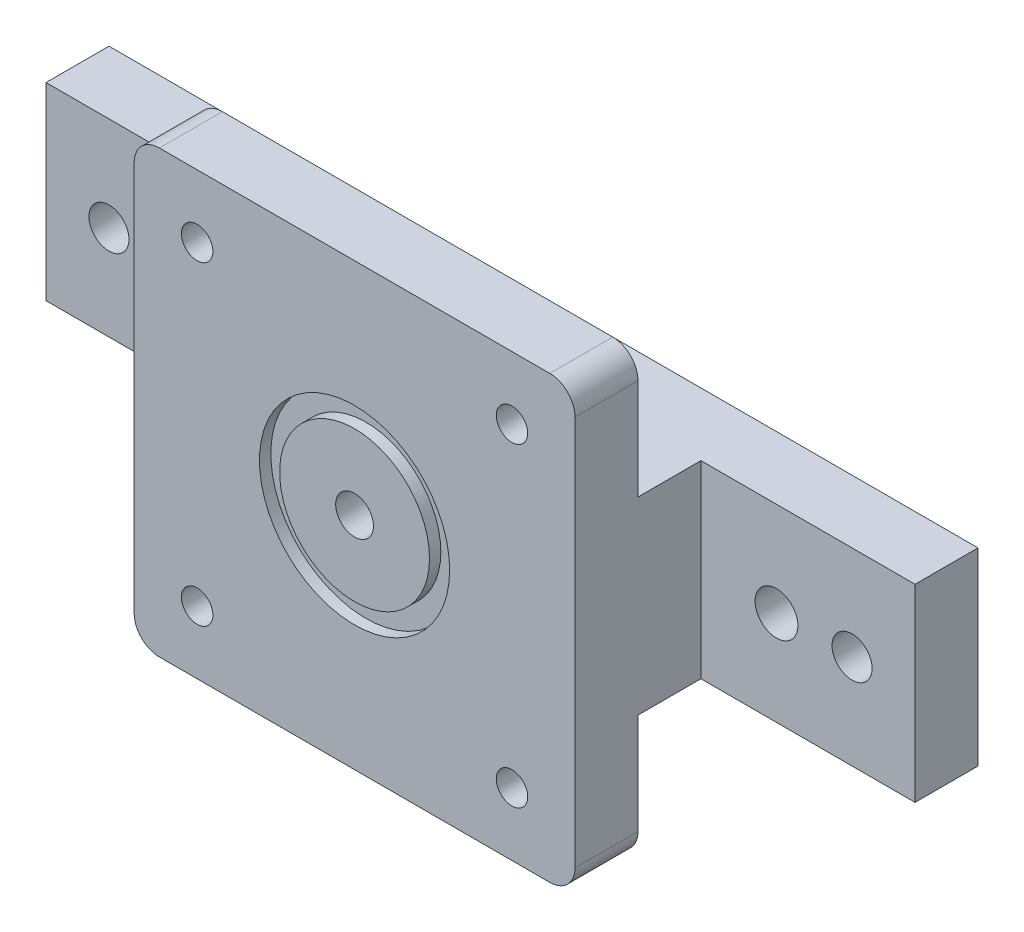
from build123d import *

# Parameters (mm, degrees)
SKETCH1_W                                = 60
SKETCH1_H                                = 20
BOSS_EXTRUDE1_DEPTH                      = 37
CUT_EXTRUDE2_DEPTH                       = 74.273460407
CUT_EXTRUDE2_DEPTH_BACK                  = 74.273460407
SKETCH7_W                                = 60
SKETCH7_H                                = 5
SKETCH16_R                               = 1.75
BOSS_EXTRUDE3_DEPTH                      = 1.85
SKETCH27_W                               = 0.34
SKETCH27_H                               = 37
SKETCH27_W_2                             = 4.66
CUT_EXTRUDE9_DEPTH                       = 73.069410987
SKETCH28_W                               = 8.45
SKETCH28_H                               = 32
CUT_EXTRUDE10_DEPTH                      = 72.786597635
CUT_EXTRUDE13_DEPTH                      = 72.786597635
CUT_EXTRUDE13_DEPTH_BACK                 = 72.786597635
SKETCH35_OUTSIDE_W                       = 70.68
SKETCH35_OUTSIDE_H                       = 52.68
SKETCH35_OUTSIDE_W_2                     = 38.1
SKETCH35_OUTSIDE_H_2                     = 20
CUT_EXTRUDE14_DEPTH                      = 65.934306033
CUT_EXTRUDE14_DEPTH_BACK                 = 65.934306033
SKETCH39_W                               = 7
SKETCH39_H                               = 10
M3_CLEARANCE_HOLE2_D                     = 3.4
TAP_DRILL_FOR_10_32_TAP1_D               = 4.0386
TAP_DRILL_FOR_10_32_TAP1_DEPTH           = 5
TAP_DRILL_FOR_10_32_TAP1_TIP             = 1.213317848
SKETCH6_R                                = 0.625
CUT_EXTRUDE1_DEPTH                       = 27
SKETCH44_W                               = 0.62
SKETCH44_H                               = 12.45
SKETCH48_R                               = 1.58
CUT_EXTRUDE17_DEPTH                      = 8
SKETCH49_R                               = 1.709194905
SKETCH49_R_2                             = 1.7
SKETCH49_R_3                             = 1.58
BOSS_EXTRUDE4_DEPTH                      = 10
BOSS_EXTRUDE5_START                      = 17
SKETCH50_W                               = 38.1
SKETCH50_H                               = 15
SKETCH50_R                               = 0.625
BOSS_EXTRUDE5_DEPTH                      = 17
SKETCH53_W                               = 15.45
SKETCH53_H                               = 15
BOSS_EXTRUDE6_DEPTH                      = 5
SKETCH54_R                               = 1.75
BOSS_EXTRUDE7_DEPTH                      = 1.85
TAP_DRILL_FOR_M2_5X0_45_TAP2_D           = 2.05
TAP_DRILL_FOR_M2_5X0_45_TAP2_DEPTH       = 4
TAP_DRILL_FOR_M2_5X0_45_TAP2_CSINK_D     = 2.1
TAP_DRILL_FOR_M2_5X0_45_TAP2_CSINK_ANGLE = 90
TAP_DRILL_FOR_M2_5X0_45_TAP2_TIP         = 0.615882135
M3_CLEARANCE_HOLE1_D                     = 3.4
SKETCH56_R                               = 1.59
CUT_EXTRUDE21_DEPTH                      = 5
SKETCH57_W                               = 13
SKETCH57_H                               = 5
CUT_EXTRUDE22_DEPTH                      = 0.8
FILLET1_R                                = 0.79
SKETCH58_W                               = 7
SKETCH58_H                               = 10
BOSS_EXTRUDE8_DEPTH                      = 15
TAP_DRILL_FOR_M3X0_5_TAP1_D              = 2.5
SKETCH59_W                               = 38.1
SKETCH59_H                               = 22
CUT_EXTRUDE23_DEPTH                      = 78.701709119
F_3_0MM_DOWEL_HOLE1_D                    = 3
F_3_0MM_DOWEL_HOLE1_DEPTH                = 5
F_3_0MM_DOWEL_HOLE1_TIP                  = 0.901290929
SKETCH65_W                               = 35
SKETCH65_H                               = 35
SKETCH65_R                               = 1
SKETCH65_R_2                             = 4
BOSS_EXTRUDE9_DEPTH                      = 5
SKETCH64_R                               = 7.55
SKETCH64_R_2                             = 5.95
CUT_EXTRUDE24_DEPTH                      = 0.9
TAP_DRILL_FOR_M3X0_5_TAP2_D              = 2.5
SKETCH68_W                               = 1.55
SKETCH68_H                               = 10
CUT_EXTRUDE25_DEPTH                      = 73.756825109
FILLET2_R                                = 2


with BuildPart() as part:
    # Sketch1 → Boss-Extrude1 (new body)
    with BuildSketch(Plane.XY):
        with Locations((30, 10)):
            Rectangle(SKETCH1_W, SKETCH1_H)
    extrude(amount=BOSS_EXTRUDE1_DEPTH)

    # Sketch7 → Cut-Extrude2 (cut, two sides: drawn at the far end of the back side and taken through both)
    with BuildSketch(Plane(origin=(0, 0, 0), x_dir=(-1, 0, 0), z_dir=(0, 0, -1)).offset(-CUT_EXTRUDE2_DEPTH_BACK)):
        with Locations((-30, 2.5)):
            Rectangle(SKETCH7_W, SKETCH7_H)
    extrude(amount=CUT_EXTRUDE2_DEPTH + CUT_EXTRUDE2_DEPTH_BACK, mode=Mode.SUBTRACT)

    # Sketch16 → Boss-Extrude3 (add)
    with BuildSketch(Plane(origin=(0, 20, 0), x_dir=(1, 0, 0), z_dir=(0, 1, 0))):
        with Locations(Location((34.7475, -4.83, 0), (0, 0, 90))):
            Circle(SKETCH16_R)
    extrude(amount=BOSS_EXTRUDE3_DEPTH)

    # Sketch27 → Cut-Extrude9 (cut, through all)
    with BuildSketch(Plane(origin=(0, 20, 0), x_dir=(1, 0, 0), z_dir=(0, 1, 0))):
        with Locations((59.83, -18.5)):
            Rectangle(SKETCH27_W, SKETCH27_H)
        with Locations((2.33, -18.5)):
            Rectangle(SKETCH27_W_2, SKETCH27_H)
    extrude(amount=-CUT_EXTRUDE9_DEPTH, mode=Mode.SUBTRACT)

    # Sketch28 → Cut-Extrude10 (cut, through all)
    with BuildSketch(Plane(origin=(0, 20, 0), x_dir=(1, 0, 0), z_dir=(0, 1, 0))):
        with Locations((55.435, -21)):
            Rectangle(SKETCH28_W, SKETCH28_H)
        with Locations((8.885, -21)):
            Rectangle(SKETCH28_W, SKETCH28_H)
    extrude(amount=-CUT_EXTRUDE10_DEPTH, mode=Mode.SUBTRACT)

    # Sketch35 outside → Cut-Extrude13 (cut, two sides: drawn at the far end of the back side and taken through both)
    with BuildSketch(Plane(origin=(0, 20, 0), x_dir=(1, 0, 0), z_dir=(0, 1, 0)).offset(-CUT_EXTRUDE13_DEPTH_BACK)):
        with Locations((32.16, -18.5)):
            Rectangle(SKETCH35_OUTSIDE_W, SKETCH35_OUTSIDE_H)
        with Locations((32.16, -27)):
            Rectangle(SKETCH35_OUTSIDE_W_2, SKETCH35_OUTSIDE_H_2, mode=Mode.SUBTRACT)
    extrude(amount=CUT_EXTRUDE13_DEPTH + CUT_EXTRUDE13_DEPTH_BACK, mode=Mode.SUBTRACT)

    # Sketch39 → Cut-Extrude14 (cut, two sides: drawn at the far end of the back side and taken through both)
    with BuildSketch(Plane(origin=(0, 20, 0), x_dir=(1, 0, 0), z_dir=(0, 1, 0)).offset(-CUT_EXTRUDE14_DEPTH_BACK)):
        with Locations((16.61, -32)):
            Rectangle(SKETCH39_W, SKETCH39_H)
        with Locations((47.71, -32)):
            Rectangle(SKETCH39_W, SKETCH39_H)
    extrude(amount=CUT_EXTRUDE14_DEPTH + CUT_EXTRUDE14_DEPTH_BACK, mode=Mode.SUBTRACT)

    # M3 Clearance Hole2 (through all)
    with Locations(Plane.XY.offset(27)):
        with Locations((17.11, 12.5), (47.21, 12.5)):
            Hole(M3_CLEARANCE_HOLE2_D / 2)

    # Tap Drill for #10-32 Tap1
    with Locations(Plane.XY.offset(37)):
        with Locations((32.16, 12.5)):
            Hole(TAP_DRILL_FOR_10_32_TAP1_D / 2, depth=TAP_DRILL_FOR_10_32_TAP1_DEPTH)
            with Locations((0, 0, -(TAP_DRILL_FOR_10_32_TAP1_DEPTH + TAP_DRILL_FOR_10_32_TAP1_TIP / 2))):  # 118° drill point
                Cone(0, TAP_DRILL_FOR_10_32_TAP1_D / 2, TAP_DRILL_FOR_10_32_TAP1_TIP, mode=Mode.SUBTRACT)

    # Sketch6 → Cut-Extrude1 (cut)
    with BuildSketch(Plane(origin=(0, 0, 17), x_dir=(-1, 0, 0), z_dir=(0, 0, -1))):
        with Locations((-32.16, 12.5)):
            Circle(SKETCH6_R)
    extrude(amount=-CUT_EXTRUDE1_DEPTH, mode=Mode.SUBTRACT)

    # Sketch44 → Cut-Revolve1 (revolve, cut)
    with BuildSketch(Plane(origin=(0, 12.5, 0), x_dir=(1, 0, 0), z_dir=(0, 1, 0))):
        Polygon((34.18, -37), (32.16, -37), (32.16, -29.45), (32.78, -29.45), (34.18, -30.29), align=None)
        with Locations((32.47, -23.225)):
            Rectangle(SKETCH44_W, SKETCH44_H)
    revolve(axis=Axis((32.16, 12.5, 37), (0, 0, -1)), mode=Mode.SUBTRACT)

    # Sketch48 → Cut-Extrude17 (cut)
    with BuildSketch(Plane(origin=(0, 0, 17), x_dir=(-1, 0, 0), z_dir=(0, 0, -1))):
        with Locations((-37.21, 15)):
            Circle(SKETCH48_R)
        with Locations((-27.11, 15)):
            Circle(SKETCH48_R)
    extrude(amount=-CUT_EXTRUDE17_DEPTH, mode=Mode.SUBTRACT)

    # Sketch49 → Boss-Extrude4 (add)
    with BuildSketch(Plane(origin=(0, 0, 17), x_dir=(-1, 0, 0), z_dir=(0, 0, -1))):
        with Locations((-47.21, 12.5)):
            Circle(SKETCH49_R)
        with Locations((-17.11, 12.5)):
            Circle(SKETCH49_R_2)
        with Locations((-27.11, 15)):
            Circle(SKETCH49_R_3)
        with Locations((-37.21, 15)):
            Circle(SKETCH49_R_3)
    extrude(amount=-BOSS_EXTRUDE4_DEPTH)

    # Sketch50 → Boss-Extrude5 (add)
    with BuildSketch(Plane(origin=(0, 0, 17), x_dir=(-1, 0, 0), z_dir=(0, 0, -1)).offset(BOSS_EXTRUDE5_START)):
        with Locations((-32.16, 12.5)):
            Rectangle(SKETCH50_W, SKETCH50_H)
        with Locations((-32.16, 12.5)):
            Circle(SKETCH50_R, mode=Mode.SUBTRACT)
    extrude(amount=-BOSS_EXTRUDE5_DEPTH)

    # Sketch53 → Boss-Extrude6 (add)
    with BuildSketch(Plane(origin=(0, 0, 0), x_dir=(-1, 0, 0), z_dir=(0, 0, -1))):
        with Locations((-5.385, 12.5)):
            Rectangle(SKETCH53_W, SKETCH53_H)
        with Locations((-58.935, 12.5)):
            Rectangle(SKETCH53_W, SKETCH53_H)
    extrude(amount=-BOSS_EXTRUDE6_DEPTH)

    # Sketch54 → Boss-Extrude7 (add)
    with BuildSketch(Plane(origin=(0, 20, 0), x_dir=(1, 0, 0), z_dir=(0, 1, 0))):
        with Locations(Location((34.7475, -4.83, 0), (0, 0, 90))):
            Circle(SKETCH54_R)
    extrude(amount=BOSS_EXTRUDE7_DEPTH)

    # Tap Drill for M2.5x0.45 Tap2
    with Locations(Plane(origin=(0, 21.85, 0), x_dir=(1, 0, 0), z_dir=(0, 1, 0))):
        with Locations((34.7475, -4.83)):
            CounterSinkHole(TAP_DRILL_FOR_M2_5X0_45_TAP2_D / 2, TAP_DRILL_FOR_M2_5X0_45_TAP2_CSINK_D / 2, depth=TAP_DRILL_FOR_M2_5X0_45_TAP2_DEPTH, counter_sink_angle=TAP_DRILL_FOR_M2_5X0_45_TAP2_CSINK_ANGLE)
            with Locations((0, 0, -(TAP_DRILL_FOR_M2_5X0_45_TAP2_DEPTH + TAP_DRILL_FOR_M2_5X0_45_TAP2_TIP / 2))):  # 118° drill point
                Cone(0, TAP_DRILL_FOR_M2_5X0_45_TAP2_D / 2, TAP_DRILL_FOR_M2_5X0_45_TAP2_TIP, mode=Mode.SUBTRACT)

    # M3 Clearance Hole1 (through all)
    with Locations(Plane(origin=(0, 0, 0), x_dir=(1, 0, 0), z_dir=(0, 0, -1))):
        with Locations((8.66, -12.5), (55.66, -12.5)):
            Hole(M3_CLEARANCE_HOLE1_D / 2)

    # Sketch56 → Cut-Extrude21 (cut)
    with BuildSketch(Plane(origin=(0, 0, 0), x_dir=(-1, 0, 0), z_dir=(0, 0, -1))):
        with Locations((-61.66, 12.5)):
            Circle(SKETCH56_R)
        with Locations((-2.66, 12.5)):
            Circle(SKETCH56_R)
    extrude(amount=-CUT_EXTRUDE21_DEPTH, mode=Mode.SUBTRACT)

    # Sketch57 → Cut-Extrude22 (cut)
    with BuildSketch(Plane(origin=(0, 0, 0), x_dir=(-1, 0, 0), z_dir=(0, 0, -1))):
        with Locations((-32.16, 12.5)):
            Rectangle(SKETCH57_W, SKETCH57_H)
    extrude(amount=-CUT_EXTRUDE22_DEPTH, mode=Mode.SUBTRACT)

    # Fillet1
    fillet1_edges = [part.edges().sort_by_distance(p)[0] for p in [
        (38.66, 10, 0.4),
        (38.66, 15, 0.4),
        (25.66, 15, 0.4),
        (25.66, 10, 0.4),
    ]]
    fillet(fillet1_edges, radius=FILLET1_R)

    # Sketch58 → Boss-Extrude8 (add)
    with BuildSketch(Plane(origin=(0, 20, 0), x_dir=(1, 0, 0), z_dir=(0, 1, 0))):
        with Locations((16.61, -32)):
            Rectangle(SKETCH58_W, SKETCH58_H)
        with Locations((47.71, -32)):
            Rectangle(SKETCH58_W, SKETCH58_H)
    extrude(amount=-BOSS_EXTRUDE8_DEPTH)

    # Tap Drill for M3x0.5 Tap1 (through all)
    with Locations(Plane(origin=(0, 5, 0), x_dir=(-1, 0, 0), z_dir=(0, -1, 0))):
        with Locations((-16.61, -33.5), (-47.71, -33.5)):
            Hole(TAP_DRILL_FOR_M3X0_5_TAP1_D / 2)

    # Sketch59 → Cut-Extrude23 (cut, through all)
    with BuildSketch(Plane(origin=(0, 20, 0), x_dir=(1, 0, 0), z_dir=(0, 1, 0))):
        with Locations((32.16, -26)):
            Rectangle(SKETCH59_W, SKETCH59_H)
    extrude(amount=-CUT_EXTRUDE23_DEPTH, mode=Mode.SUBTRACT)

    # Ø3.0mm Dowel Hole1
    with Locations(Plane.XY.offset(15)):
        with Locations((32.16, 12.5)):
            Hole(F_3_0MM_DOWEL_HOLE1_D / 2, depth=F_3_0MM_DOWEL_HOLE1_DEPTH)
            with Locations((0, 0, -(F_3_0MM_DOWEL_HOLE1_DEPTH + F_3_0MM_DOWEL_HOLE1_TIP / 2))):  # 118° drill point
                Cone(0, F_3_0MM_DOWEL_HOLE1_D / 2, F_3_0MM_DOWEL_HOLE1_TIP, mode=Mode.SUBTRACT)

    # Sketch65 → Boss-Extrude9 (add)
    with BuildSketch(Plane.XY.offset(15)):
        with Locations((32.16, 12.5)):
            Rectangle(SKETCH65_W, SKETCH65_H)
        with Locations((19.66, 25)):
            Circle(SKETCH65_R, mode=Mode.SUBTRACT)
        with Locations((44.66, 25)):
            Circle(SKETCH65_R, mode=Mode.SUBTRACT)
        with Locations((44.66, 0)):
            Circle(SKETCH65_R, mode=Mode.SUBTRACT)
        with Locations((19.66, 0)):
            Circle(SKETCH65_R, mode=Mode.SUBTRACT)
        with Locations((32.16, 12.5)):
            Circle(SKETCH65_R_2, mode=Mode.SUBTRACT)
    extrude(amount=-BOSS_EXTRUDE9_DEPTH)

    # Sketch64 → Cut-Extrude24 (cut)
    with BuildSketch(Plane.XY.offset(15)):
        with Locations((32.16, 12.5)):
            Circle(SKETCH64_R)
        with Locations((32.16, 12.5)):
            Circle(SKETCH64_R_2, mode=Mode.SUBTRACT)
    extrude(amount=-CUT_EXTRUDE24_DEPTH, mode=Mode.SUBTRACT)

    # Tap Drill for M3x0.5 Tap2 (through all)
    with Locations(Plane.XY.offset(15)):
        with Locations((19.66, 0), (19.66, 25), (44.66, 25), (44.66, 0)):
            Hole(TAP_DRILL_FOR_M3X0_5_TAP2_D / 2)

    # Sketch68 → Cut-Extrude25 (cut, through all)
    with BuildSketch(Plane(origin=(0, 20, 0), x_dir=(1, 0, 0), z_dir=(0, 1, 0))):
        with Locations((13.885, -10)):
            Rectangle(SKETCH68_W, SKETCH68_H)
        with Locations((50.435, -10)):
            Rectangle(SKETCH68_W, SKETCH68_H)
    extrude(amount=-CUT_EXTRUDE25_DEPTH, mode=Mode.SUBTRACT)

    # Fillet2
    fillet2_edges = [part.edges().sort_by_distance(p)[0] for p in [
        (14.66, -5, 12.5),
        (49.66, 30, 12.5),
        (14.66, 30, 12.5),
        (49.66, -5, 12.5),
    ]]
    fillet(fillet2_edges, radius=FILLET2_R)


solid = part.part
